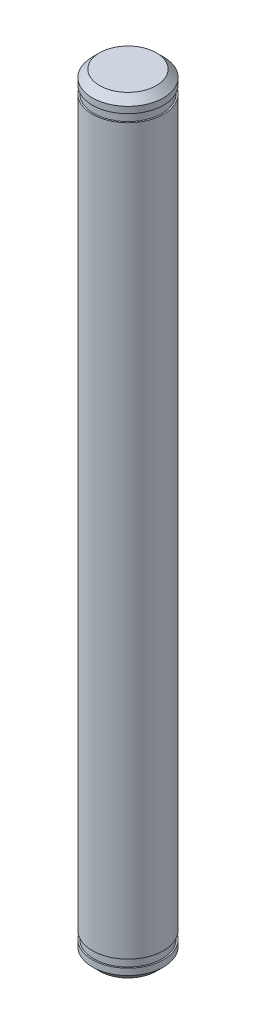
from build123d import *

# Parameters (mm, degrees)
CHAMFER_1_SIZE      = 1
CUT_EXTRUDE_START   = -3
SKETCH_2_R          = 5
SKETCH_2_R_2        = 4.8
CUT_EXTRUDE_1_DEPTH = 1.1


with BuildPart() as part:
    # 草图1 → 旋转1 (revolve)
    with BuildSketch(Plane.XY, mode=Mode.PRIVATE) as revolve_1_sk:
        Polygon((0, 54), (5, 54), (5, 30), (5, -30), (5, -54), (0, -54), align=None)
    revolve(revolve_1_sk.sketch.rotate(Axis((0, 54, 0), (0, -1, 0)), 180), axis=Axis((0, 54, 0), (0, -1, 0)))

    # 倒角1
    chamfer_1_edges = [part.edges().sort_by_distance(p)[0] for p in [
        (5, -54, 0),
        (5, 54, 0),
    ]]
    chamfer(chamfer_1_edges, length=CHAMFER_1_SIZE)

    # 草图2 → 切除-拉伸1 (cut)
    with BuildSketch(Plane(origin=(0, 54, 0), x_dir=(1, 0, 0), z_dir=(0, 1, 0)).offset(CUT_EXTRUDE_START)):
        with Locations(Location((0, 0, 0), (0, 0, 180))):
            Circle(SKETCH_2_R)
        with Locations(Location((0, 0, 0), (0, 0, 180))):
            Circle(SKETCH_2_R_2, mode=Mode.SUBTRACT)
    cut_extrude_1 = extrude(amount=CUT_EXTRUDE_1_DEPTH, mode=Mode.SUBTRACT)

    # 镜向1: 切除-拉伸1 across plane
    add(cut_extrude_1.mirror(Plane.ZX), mode=Mode.SUBTRACT)


solid = part.part
